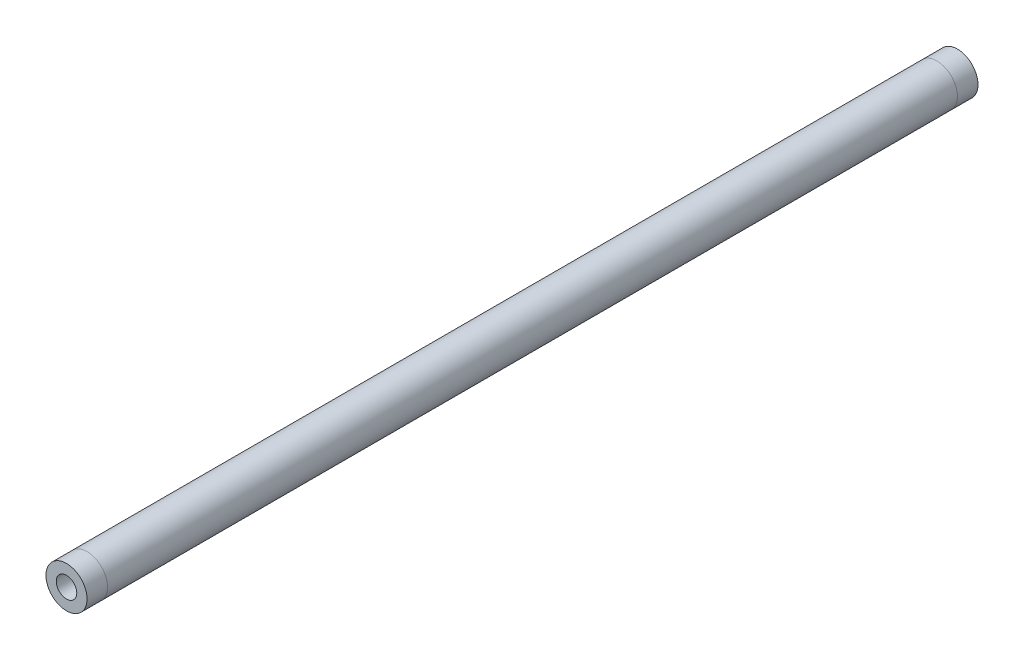
from build123d import *

# Parameters (mm, degrees)
SKETCH1_R                 = 6.35
SKETCH1_R_2               = 5.461
SKETCH1_R_3               = 3.175
THREADED_INSERT_1_1_DEPTH = 6.35
THREADED_START            = -6.35
SKETCH1_3_R               = 5.461
SKETCH1_3_R_2             = 3.175
THREADED_INSERT_1_2_DEPTH = 9.525
TUBE_START                = -6.35
SKETCH1_4_R               = 6.35
SKETCH1_4_R_2             = 5.461
TUBE_EXTRUDE_DEPTH        = 262.664018
THREADED_START_2          = -269.014018
SKETCH1_6_R               = 5.461
SKETCH1_6_R_2             = 3.175
THREADED_INSERT_2_1_DEPTH = 9.525
SKETCH1_9_R               = 6.35
SKETCH1_9_R_2             = 5.461
SKETCH1_9_R_3             = 3.175
THREADED_INSERT_2_2_DEPTH = 6.35


with BuildPart() as part:
    # Sketch1 → Threaded insert 1-1 (new body)
    # profile 1 of 2: a face of its own
    with BuildSketch(Plane.XY):
        Circle(SKETCH1_R)
        Circle(SKETCH1_R_2, mode=Mode.SUBTRACT)
    # profile 2 of 2: a face of its own
    with BuildSketch(Plane.XY):
        Circle(SKETCH1_R_2)
        Circle(SKETCH1_R_3, mode=Mode.SUBTRACT)
    extrude(amount=-THREADED_INSERT_1_1_DEPTH)

    # Sketch1<3> → Threaded insert 1-2 (add)
    with BuildSketch(Plane.XY.offset(THREADED_START)):
        Circle(SKETCH1_3_R)
        Circle(SKETCH1_3_R_2, mode=Mode.SUBTRACT)
    extrude(amount=-THREADED_INSERT_1_2_DEPTH)


with BuildPart() as body_2:
    # Sketch1<4> → Tube extrude (new body)
    with BuildSketch(Plane.XY.offset(TUBE_START)):
        Circle(SKETCH1_4_R)
        Circle(SKETCH1_4_R_2, mode=Mode.SUBTRACT)
    extrude(amount=-TUBE_EXTRUDE_DEPTH)


with BuildPart() as body_3:
    # Sketch1<6> → Threaded insert 2-1 (new body)
    with BuildSketch(Plane.XY.offset(THREADED_START_2)):
        Circle(SKETCH1_6_R)
        Circle(SKETCH1_6_R_2, mode=Mode.SUBTRACT)
    extrude(amount=THREADED_INSERT_2_1_DEPTH)


with BuildPart() as body_4:
    # Sketch1<9> → Threaded insert 2-2 (new body)
    # profile 1 of 2: a face of its own
    with BuildSketch(Plane.XY.offset(THREADED_START_2)):
        Circle(SKETCH1_9_R)
        Circle(SKETCH1_9_R_2, mode=Mode.SUBTRACT)
    # profile 2 of 2: a face of its own
    with BuildSketch(Plane.XY.offset(THREADED_START_2)):
        Circle(SKETCH1_9_R_2)
        Circle(SKETCH1_9_R_3, mode=Mode.SUBTRACT)
    extrude(amount=-THREADED_INSERT_2_2_DEPTH)

    # Combine1: union body 3
    add(body_3.part)


solid = Compound([part.part, body_2.part, body_4.part])
